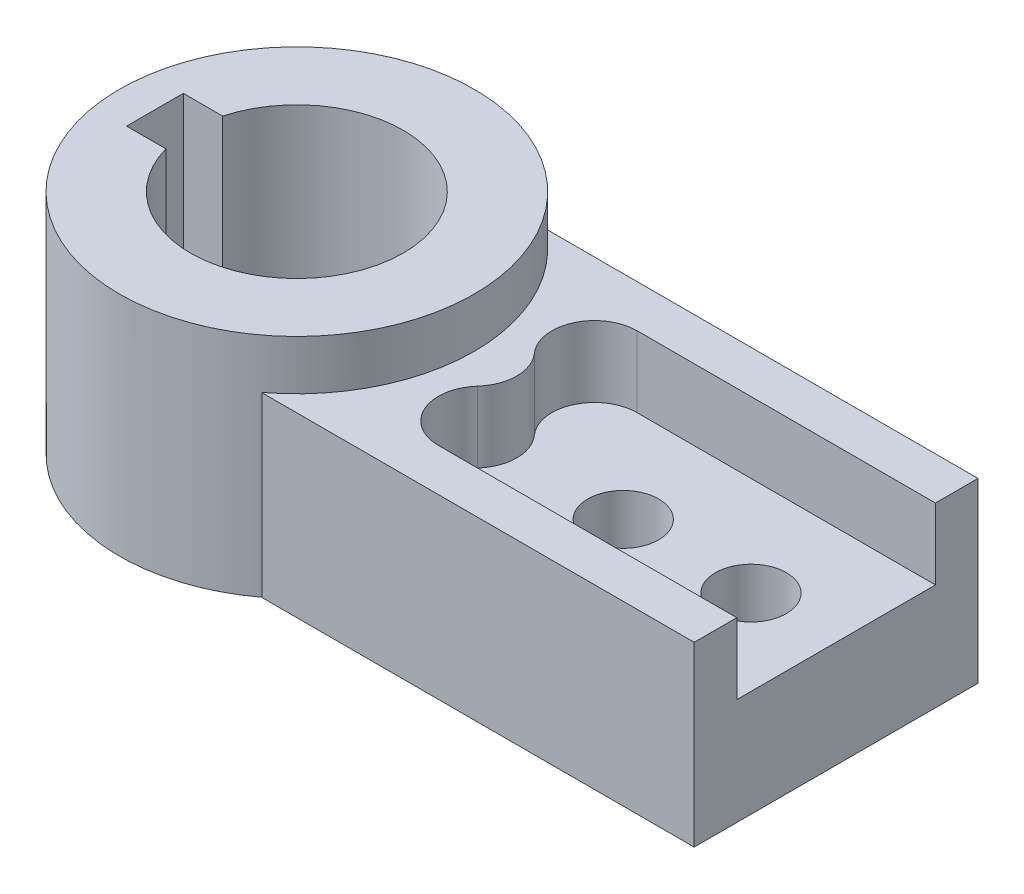
from build123d import *

# Parameters (mm, degrees)
SKETCH_1_R          = 25
SKETCH_1_R_2        = 15
EXTRUDE_1_DEPTH     = 32
EXTRUDE_START       = -32
SKETCH_2_W          = 60.925429914
SKETCH_2_H          = 40
EXTRUDE_2_DEPTH     = 25
CUT_EXTRUDE_1_DEPTH = 10
SKETCH_4_R          = 5
CUT_EXTRUDE_2_DEPTH = 48
CUT_EXTRUDE_START   = -48
CUT_EXTRUDE_3_DEPTH = 48


with BuildPart() as part:
    # 草图1 → 凸台-拉伸1 (new body)
    with BuildSketch(Plane(origin=(0, 0, 0), x_dir=(1, 0, 0), z_dir=(0, 1, 0))):
        with Locations(Location((0, 0, 0), (0, 0, 270))):
            Circle(SKETCH_1_R)
        with Locations(Location((0, 0, 0), (0, 0, 270))):
            Circle(SKETCH_1_R_2, mode=Mode.SUBTRACT)
    extrude(amount=EXTRUDE_1_DEPTH)

    # 草图2 → 凸台-拉伸2 (add)
    with BuildSketch(Plane(origin=(0, 32, 0), x_dir=(1, 0, 0), z_dir=(0, 1, 0)).offset(EXTRUDE_START)):
        with Locations((45.537285043, 0)):
            Rectangle(SKETCH_2_W, SKETCH_2_H)
    extrude(amount=EXTRUDE_2_DEPTH)

    # 草图3 → 切除-拉伸1 (cut)
    with BuildSketch(Plane(origin=(0, 25, 0), x_dir=(1, 0, 0), z_dir=(0, 1, 0))):
        with BuildLine():
            Line((76, 14), (33.94427191, 14))
            ThreePointArc((33.94427191, 14), (28.467046335, 10.449489743), (29.472135955, 4))
            ThreePointArc((29.472135955, 4), (31, 0), (29.472135955, -4))
            ThreePointArc((29.472135955, -4), (28.467046335, -10.449489743), (33.94427191, -14))
            Line((33.94427191, -14), (76, -14))
            Line((76, -14), (76, 14))
        make_face()
    extrude(amount=-CUT_EXTRUDE_1_DEPTH, mode=Mode.SUBTRACT)

    # 草图4 → 切除-拉伸2 (cut)
    with BuildSketch(Plane(origin=(0, 15, 0), x_dir=(1, 0, 0), z_dir=(0, 1, 0))):
        with Locations(Location((46, 0, 0), (0, 0, 270))):
            Circle(SKETCH_4_R)
        with Locations(Location((64, 0, 0), (0, 0, 270))):
            Circle(SKETCH_4_R)
    extrude(amount=-CUT_EXTRUDE_2_DEPTH, mode=Mode.SUBTRACT)

    # 草图5 → 切除-拉伸3 (cut)
    with BuildSketch(Plane(origin=(0, 32, 0), x_dir=(1, 0, 0), z_dir=(0, 1, 0)).offset(CUT_EXTRUDE_START)):
        with BuildLine():
            Line((-20, 4), (-14.456832295, 4))
            ThreePointArc((-14.456832295, 4), (-15, 0), (-14.456832295, -4))
            Line((-14.456832295, -4), (-20, -4))
            Line((-20, -4), (-20, 4))
        make_face()
    extrude(amount=CUT_EXTRUDE_3_DEPTH, mode=Mode.SUBTRACT)


solid = part.part
